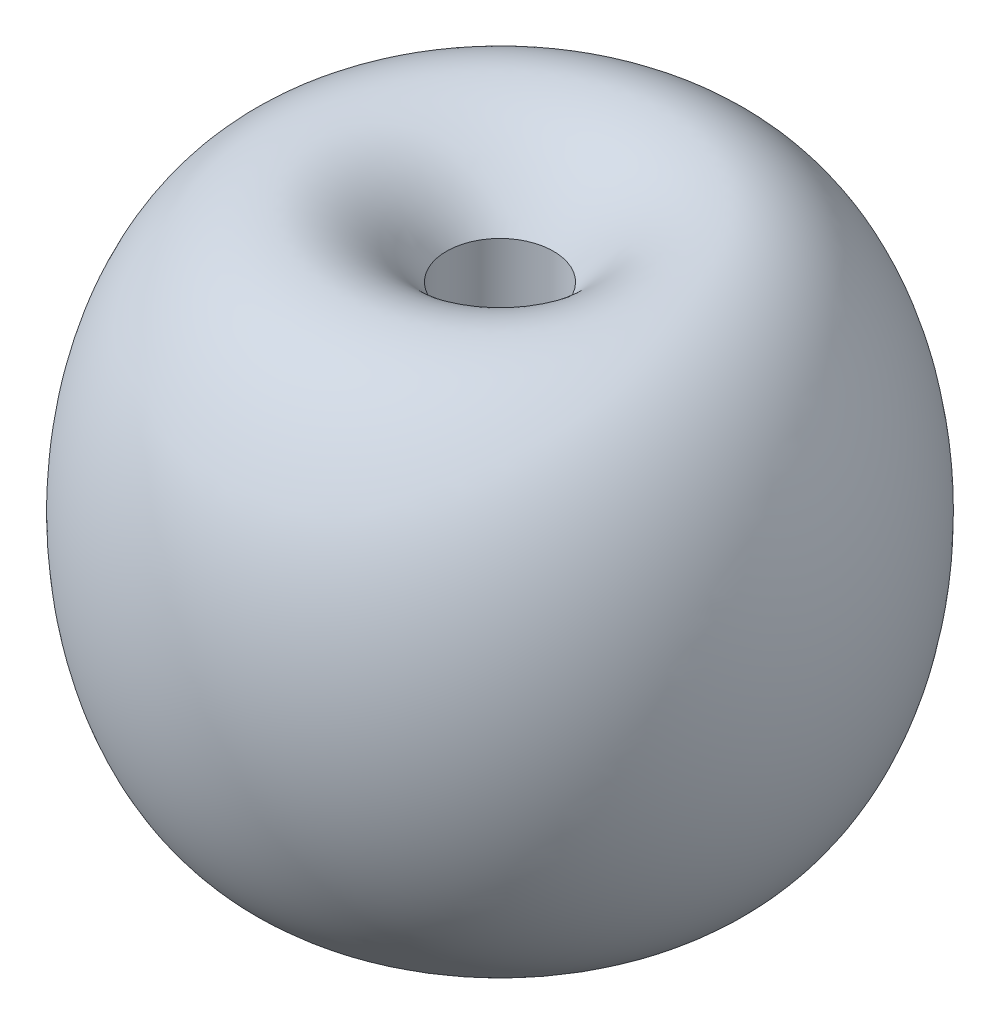
from build123d import *


with BuildPart() as part:
    # Sketch1 → apple (revolve)
    with BuildSketch(Plane.XY, mode=Mode.PRIVATE) as apple_sk:
        with BuildLine():
            Line((-5, 18.633899812), (-5, -18.633899812))
            add(Edge.make_bspline(
                [(-5, 18.633899812), (-30, 55.901699437), (-30, 0), (-30, -55.901699437), (-5, -18.633899812)],
                knots=[5.553457651, 5.553457651, 5.553457651, 7.853981634, 7.853981634, 10.154505617, 10.154505617, 10.154505617], degree=2, weights=[1, 0.40824829, 1, 0.40824829, 1]))
        make_face()
    revolve(apple_sk.sketch.rotate(Axis((0, 30, 0), (0, -1, 0)), 270), axis=Axis((0, 30, 0), (0, -1, 0)))


solid = part.part
